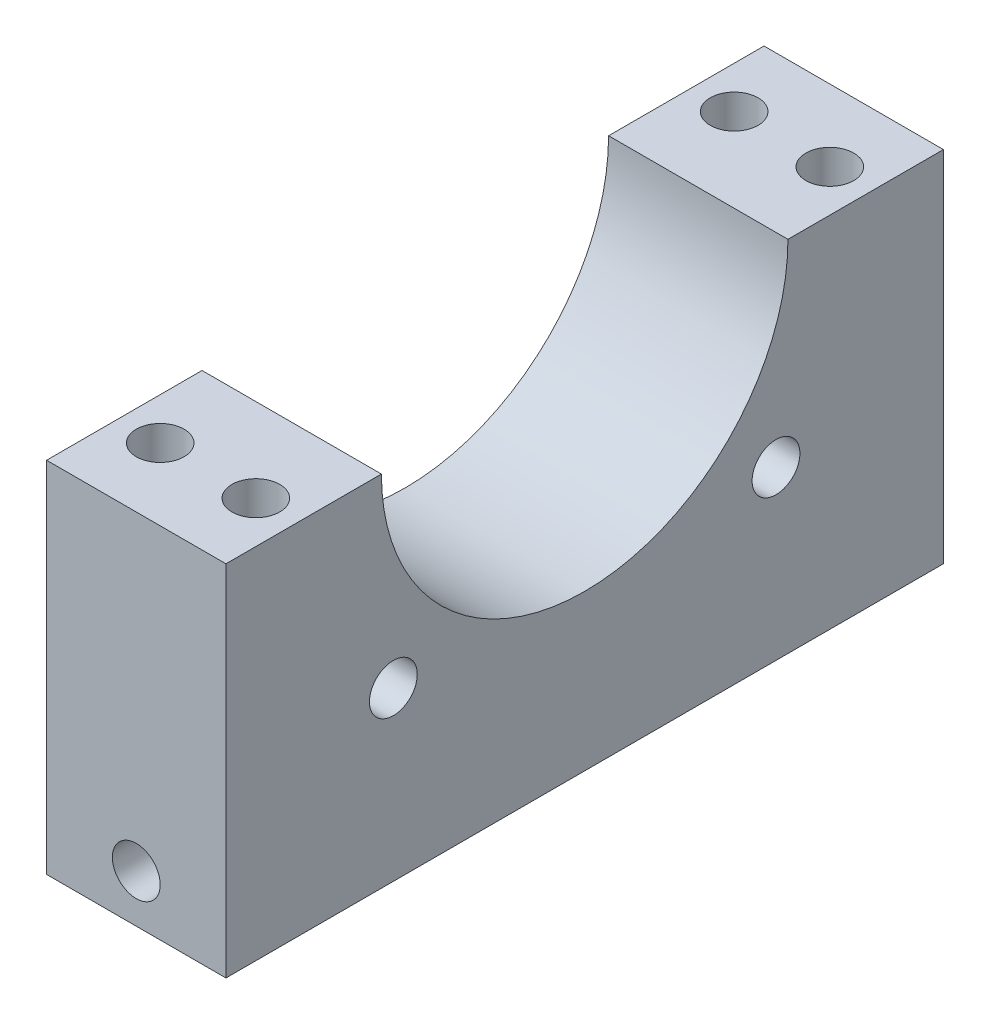
from build123d import *

# Parameters (mm, degrees)
SKETCH1_W           = 15
SKETCH1_H           = 60
BOSS_EXTRUDE1_DEPTH = 70
SKETCH2_R           = 17
CUT_EXTRUDE1_DEPTH  = 70
SKETCH3_W           = 60
SKETCH3_H           = 40
CUT_EXTRUDE2_DEPTH  = 29
SKETCH4_R           = 2
CUT_EXTRUDE3_DEPTH  = 6
SKETCH5_R           = 2
CUT_EXTRUDE4_DEPTH  = 10
SKETCH6_R           = 2
CUT_EXTRUDE5_DEPTH  = 14
CUT_EXTRUDE6_START  = -14
SKETCH7_R           = 2
CUT_EXTRUDE6_DEPTH  = 14


with BuildPart() as part:
    # Sketch1 → Boss-Extrude1 (new body)
    with BuildSketch(Plane(origin=(0, 0, 0), x_dir=(1, 0, 0), z_dir=(0, 1, 0))):
        Rectangle(SKETCH1_W, SKETCH1_H)
    extrude(amount=BOSS_EXTRUDE1_DEPTH)

    # Sketch2 → Cut-Extrude1 (cut)
    with BuildSketch(Plane(origin=(7.5, 0, 0), x_dir=(0, 0, -1), z_dir=(1, 0, 0))):
        with Locations((0, 30)):
            Circle(SKETCH2_R)
    extrude(amount=-CUT_EXTRUDE1_DEPTH, mode=Mode.SUBTRACT)

    # Sketch3 → Cut-Extrude2 (cut)
    with BuildSketch(Plane(origin=(7.5, 0, 0), x_dir=(0, 0, -1), z_dir=(1, 0, 0))):
        with Locations((0, 50)):
            Rectangle(SKETCH3_W, SKETCH3_H)
    extrude(amount=-CUT_EXTRUDE2_DEPTH, mode=Mode.SUBTRACT)

    # Sketch4 → Cut-Extrude3 (cut)
    with BuildSketch(Plane(origin=(0, 30, 0), x_dir=(1, 0, 0), z_dir=(0, 1, 0))):
        with Locations(Location((-4, 24, 0), (0, 0, 270))):
            Circle(SKETCH4_R)
        with Locations(Location((4, 24, 0), (0, 0, 270))):
            Circle(SKETCH4_R)
        with Locations(Location((-4, -24, 0), (0, 0, 270))):
            Circle(SKETCH4_R)
        with Locations(Location((4, -24, 0), (0, 0, 270))):
            Circle(SKETCH4_R)
    extrude(amount=-CUT_EXTRUDE3_DEPTH, mode=Mode.SUBTRACT)

    # Sketch5 → Cut-Extrude4 (cut)
    with BuildSketch(Plane(origin=(7.5, 0, 0), x_dir=(0, 0, -1), z_dir=(1, 0, 0))):
        with Locations((-16, 14)):
            Circle(SKETCH5_R)
        with Locations((16, 14)):
            Circle(SKETCH5_R)
    extrude(amount=-CUT_EXTRUDE4_DEPTH, mode=Mode.SUBTRACT)

    # Sketch6 → Cut-Extrude5 (cut)
    with BuildSketch(Plane(origin=(0, 0, -30), x_dir=(-1, 0, 0), z_dir=(0, 0, -1))):
        with Locations((0, 4)):
            Circle(SKETCH6_R)
    extrude(amount=-CUT_EXTRUDE5_DEPTH, mode=Mode.SUBTRACT)

    # Sketch7 → Cut-Extrude6 (cut)
    with BuildSketch(Plane.XY.offset(30).offset(CUT_EXTRUDE6_START)):
        with Locations(Location((0, 4, 0), (0, 0, 180))):
            Circle(SKETCH7_R)
    extrude(amount=CUT_EXTRUDE6_DEPTH, mode=Mode.SUBTRACT)


solid = part.part
